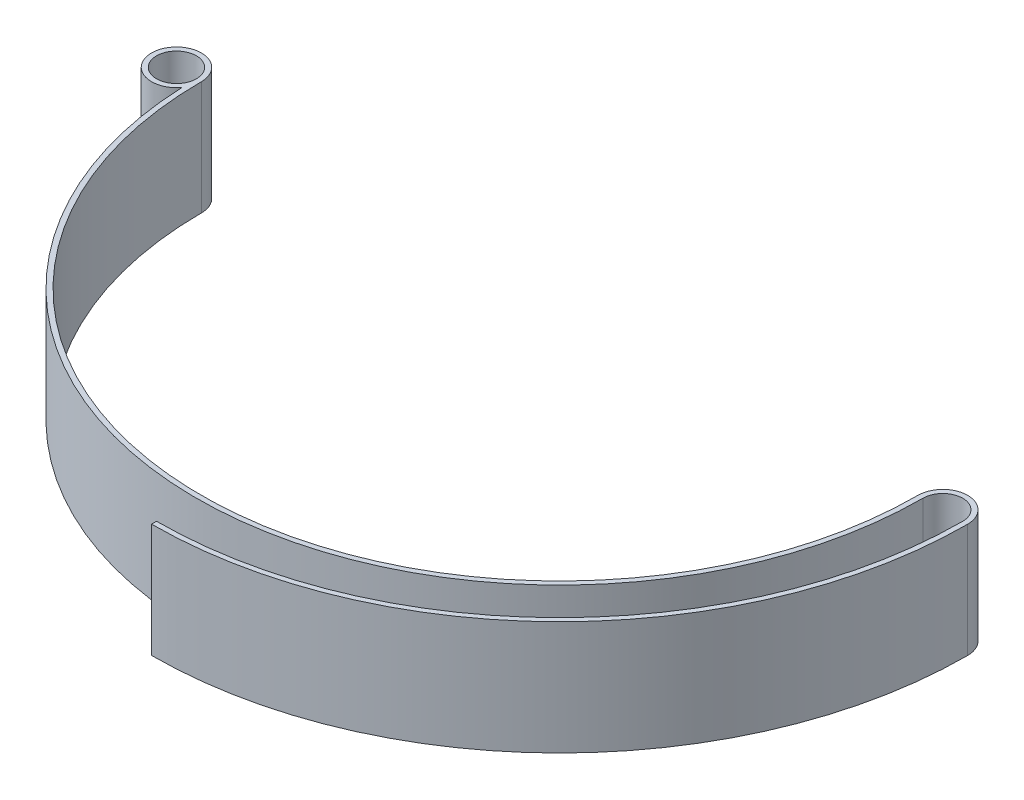
from build123d import *

# Parameters (mm, degrees)
SKETCH1_R           = 4
BOSS_EXTRUDE1_DEPTH = 22.806


with BuildPart() as part:
    # Sketch1 → Boss-Extrude1 (new body)
    with BuildSketch(Plane(origin=(0, 0, 0), x_dir=(1, 0, 0), z_dir=(0, 1, 0))):
        with BuildLine():
            Line((76.845, -80.845), (76.845, -81.845))
            ThreePointArc((76.845, -81.845), (134.718154506, -57.873154506), (158.69, 0))
            ThreePointArc((158.69, 0), (153.69, 5), (148.69, 0))
            ThreePointArc((148.69, 0), (76.845, -71.845), (5, 0))
            ThreePointArc((5, 0), (-4.758823236, 1.534145171), (4.058559438, -2.920290275))
            ThreePointArc((4.058559438, -2.920290275), (78.305438675, -72.830358669), (149.69, 0))
            ThreePointArc((149.69, 0), (153.69, 4), (157.69, 0))
            ThreePointArc((157.69, 0), (134.011047725, -57.166047725), (76.845, -80.845))
        make_face()
        with Locations(Location((0, 0, 0), (0, 0, 270))):
            Circle(SKETCH1_R, mode=Mode.SUBTRACT)
    extrude(amount=BOSS_EXTRUDE1_DEPTH)


solid = part.part
